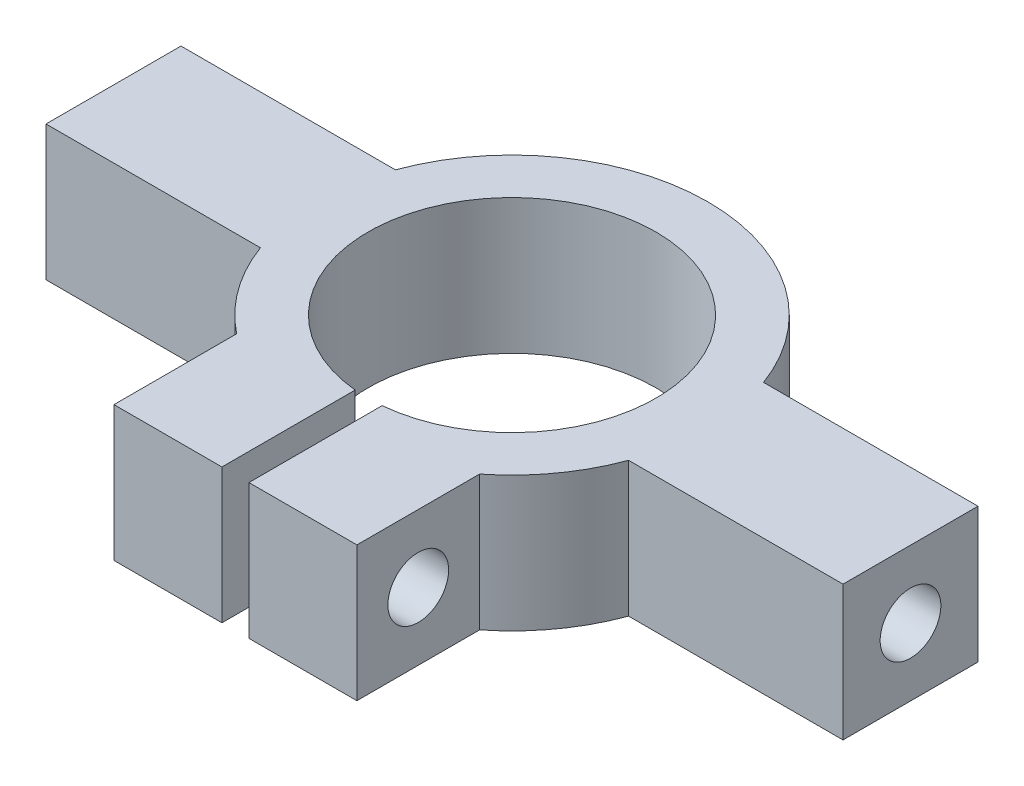
from build123d import *

# Parameters (mm, degrees)
CROQUIS1_R              = 10.668000000000001
SALIENTE_EXTRUIR1_DEPTH = 5
CORTAR_EXTRUIR1_REACH   = 55.921
CROQUIS2_R              = 2.249999999999999
SALIENTE_EXTRUIR2_DEPTH = 2.5
CORTAR_EXTRUIR5_DEPTH   = 55.61204651906025
SALIENTE_EXTRUIR3_DEPTH = 10
CORTAR_EXTRUIR6_REACH   = 65.994
CROQUIS9_R              = 2.250000000000002
CORTAR_EXTRUIR7_DEPTH   = 60.57595316665593
SALIENTE_EXTRUIR4_DEPTH = 10
CROQUIS12_R             = 2.249999999999999
CORTAR_EXTRUIR8_DEPTH   = 10


with BuildPart() as part:
    # Croquis1 → Saliente-Extruir1 (new, symmetric)
    with BuildSketch(Plane(origin=(0, 0, 0), x_dir=(1, 0, 0), z_dir=(0, 1, 0))):
        with BuildLine():
            Line((30, 1.163e-14), (-30, -6.74e-15))
            Line((-30, -6.74e-15), (-29.999999999999993, -10.000000000000007))
            Line((-29.999999999999993, -10.000000000000007), (-4.999999999999997, -9.999999999999998))
            Line((-4.999999999999997, -9.999999999999998), (-4.999999999999997, -16.362711963150442))
            ThreePointArc((-4.999999999999997, -16.362711963150442), (1.01e-15, -44.525000000000006), (5.000000000000002, -16.362711963150442))
            Line((5.000000000000002, -16.362711963150442), (5.000000000000001, -9.999999999999993))
            Line((5.000000000000001, -9.999999999999993), (30, -9.999999999999988))
            Line((30, -9.999999999999988), (30, 1.163e-14))
        make_face()
        with Locations(Location((3.67e-15, -30, 0), (0, 0, 270))):
            Circle(CROQUIS1_R, mode=Mode.SUBTRACT)
    extrude(amount=SALIENTE_EXTRUIR1_DEPTH, both=True)

    # Croquis2 → Cortar-Extruir1 (cut, up to next)
    with BuildSketch(Plane(origin=(0, 0, 0), x_dir=(-1, 0, 3.1e-16), z_dir=(-3.1e-16, 0, -1)), mode=Mode.PRIVATE) as cortar_extruir1_sk1:
        with Locations((24.999999999999996, 0)):
            Circle(CROQUIS2_R)
    cortar_extruir1_tool1 = extrude(cortar_extruir1_sk1.sketch, amount=-CORTAR_EXTRUIR1_REACH, mode=Mode.PRIVATE) & part.part
    # Croquis2 → Cortar-Extruir1 (cut, up to next)
    with BuildSketch(Plane(origin=(0, 0, 0), x_dir=(-1, 0, 3.1e-16), z_dir=(-3.1e-16, 0, -1)), mode=Mode.PRIVATE) as cortar_extruir1_sk2:
        with Locations((-24.999999999999996, 0)):
            Circle(CROQUIS2_R)
    cortar_extruir1_tool2 = extrude(cortar_extruir1_sk2.sketch, amount=-CORTAR_EXTRUIR1_REACH, mode=Mode.PRIVATE) & part.part
    add(cortar_extruir1_tool1.solids().sort_by_distance((-25, 0, 0))[0], mode=Mode.SUBTRACT)
    add(cortar_extruir1_tool2.solids().sort_by_distance((25, 0, 0))[0], mode=Mode.SUBTRACT)

    # Croquis3 → Saliente-Extruir2 (add, symmetric)
    with BuildSketch(Plane(origin=(0, 0, 0), x_dir=(1, 0, 0), z_dir=(0, 1, 0))):
        with BuildLine():
            ThreePointArc((-4.999999999999991, -16.362711963150442), (-12.83879356101969, -23.207282951754927), (-14.087370599725464, -33.53858934972546))
            Line((-14.087370599725464, -33.53858934972546), (-19.999999999999996, -10.000000000000007))
            Line((-19.999999999999996, -10.000000000000007), (-4.999999999999997, -9.999999999999998))
            Line((-4.999999999999997, -9.999999999999998), (-4.999999999999991, -16.362711963150442))
        make_face()
        with BuildLine():
            Line((4.999999999999997, -9.999999999999998), (4.999999999999991, -16.362711963150442))
            ThreePointArc((4.999999999999991, -16.362711963150442), (12.838793561019703, -23.20728295175493), (14.087370599725464, -33.53858934972546))
            Line((14.087370599725464, -33.53858934972546), (19.999999999999996, -10.000000000000007))
            Line((19.999999999999996, -10.000000000000007), (4.999999999999997, -9.999999999999998))
        make_face()
    extrude(amount=SALIENTE_EXTRUIR2_DEPTH, both=True)

    # Croquis7 → Cortar-Extruir5 (cut, through all)
    with BuildSketch(Plane(origin=(0, 5, 0), x_dir=(1, 0, 0), z_dir=(0, 1, 0))):
        Polygon((1.0000000000000004, -46.5965), (-0.9999999999999998, -46.5965), (-0.9999999999999996, -38.5965), (1.0000000000000004, -38.5965), align=None)
    extrude(amount=-CORTAR_EXTRUIR5_DEPTH, mode=Mode.SUBTRACT)

    # Croquis8 → Saliente-Extruir3 (add)
    with BuildSketch(Plane(origin=(0, 5, 0), x_dir=(1, 0, 0), z_dir=(0, 1, 0))):
        with BuildLine():
            Line((-0.9999999999999998, -44.49053570438305), (-0.9999999999999989, -50.49053570438305))
            Line((-0.9999999999999989, -50.49053570438305), (-9, -50.490535704383056))
            Line((-9, -50.490535704383056), (-8.999999999999998, -41.400685286420284))
            ThreePointArc((-8.999999999999998, -41.400685286420284), (-5.233239331556143, -43.5494956031084), (-0.9999999999999998, -44.49053570438305))
        make_face()
        with BuildLine():
            Line((9, -50.490535704383056), (8.999999999999998, -41.400685286420284))
            ThreePointArc((8.999999999999998, -41.400685286420284), (5.23323933155614, -43.5494956031084), (0.9999999999999996, -44.49053570438305))
            Line((0.9999999999999996, -44.49053570438305), (0.9999999999999989, -50.49053570438305))
            Line((0.9999999999999989, -50.49053570438305), (9, -50.490535704383056))
        make_face()
    extrude(amount=-SALIENTE_EXTRUIR3_DEPTH)

    # Cortar-Extruir6: up to this face of the body (flat: up to its plane)
    cortar_extruir6_end = Plane(part.part.faces().sort_by_distance((-9, 0, 45.945610495))[0])
    # Croquis9 → Cortar-Extruir6 (cut, up to the picked face)
    with BuildSketch(Plane(origin=(8.99999999999999, 0, -1.72e-15), x_dir=(0, 0, -1), z_dir=(1, 0, 0)), mode=Mode.PRIVATE) as cortar_extruir6_sk1:
        with Locations((-45.945610495401674, 0)):
            Circle(CROQUIS9_R)
    cortar_extruir6_tool1 = split(extrude(cortar_extruir6_sk1.sketch, amount=-CORTAR_EXTRUIR6_REACH, mode=Mode.PRIVATE), bisect_by=cortar_extruir6_end, keep=Keep.BOTH, mode=Mode.PRIVATE)
    add(cortar_extruir6_tool1.solids().sort_by(Axis((9, 0, 45.94561), (-1, 0, 0)))[0], mode=Mode.SUBTRACT)

    # Croquis10 → Cortar-Extruir7 (cut, through all)
    with BuildSketch(Plane(origin=(0, 5, 0), x_dir=(1, 0, 0), z_dir=(0, 1, 0))):
        with BuildLine():
            ThreePointArc((-4.999999999999991, -16.362711963150442), (4.56e-15, -15.475), (5, -16.362711963150446))
            Line((5, -16.362711963150446), (5.000000000000001, -9.999999999999993))
            Line((5.000000000000001, -9.999999999999993), (30, -9.999999999999988))
            Line((30, -9.999999999999988), (30, 1.163e-14))
            Line((30, 1.163e-14), (-30, -6.74e-15))
            Line((-30, -6.74e-15), (-29.999999999999993, -10.000000000000007))
            Line((-29.999999999999993, -10.000000000000007), (-4.999999999999997, -9.999999999999998))
            Line((-4.999999999999997, -9.999999999999998), (-4.999999999999991, -16.362711963150442))
        make_face()
        with BuildLine():
            ThreePointArc((-14.087370599725464, -33.53858934972547), (-12.838793561019695, -23.207282951754934), (-4.999999999999991, -16.362711963150442))
            Line((-4.999999999999991, -16.362711963150442), (-4.999999999999997, -9.999999999999998))
            Line((-4.999999999999997, -9.999999999999998), (-20, -10.000000000000004))
            Line((-20, -10.000000000000004), (-14.087370599725462, -33.53858934972547))
        make_face()
        with BuildLine():
            Line((20.000000000000004, -9.99999999999999), (5, -9.999999999999993))
            Line((5.000000000000001, -9.999999999999993), (5.000000000000002, -16.362711963150442))
            ThreePointArc((5, -16.36271196315044), (12.838793561019697, -23.207282951754934), (14.08737059972547, -33.53858934972546))
            Line((14.087370599725467, -33.53858934972546), (20.000000000000004, -9.99999999999999))
        make_face()
    extrude(amount=-CORTAR_EXTRUIR7_DEPTH, mode=Mode.SUBTRACT)

    # Croquis11 → Saliente-Extruir4 (add)
    with BuildSketch(Plane(origin=(0, 5, 0), x_dir=(1, 0, 0), z_dir=(0, 1, 0))):
        with BuildLine():
            Line((29.525000000000002, -34.99999999999999), (29.525, -25))
            Line((29.525, -25), (13.637288036849554, -25))
            ThreePointArc((13.637288036849554, -25), (14.525, -30), (13.637288036849556, -35))
            Line((13.637288036849556, -35), (29.525000000000002, -34.99999999999999))
        make_face()
        with BuildLine():
            Line((-29.525000000000002, -34.99999999999999), (-13.637288036849556, -35))
            ThreePointArc((-13.637288036849556, -35), (-14.525, -30.000000000000004), (-13.637288036849554, -25))
            Line((-13.637288036849554, -25), (-29.525, -25))
            Line((-29.525, -25), (-29.525000000000002, -34.99999999999999))
        make_face()
    extrude(amount=-SALIENTE_EXTRUIR4_DEPTH)

    # Croquis12 → Cortar-Extruir8 (cut)
    with BuildSketch(Plane(origin=(29.524999999999988, 0, -1.024e-14), x_dir=(-3.5e-16, 0, -1), z_dir=(1, 0, -3.5e-16))):
        with Locations((-30.000000000000007, -8.7e-16)):
            Circle(CROQUIS12_R)
    cortar_extruir8 = extrude(amount=-CORTAR_EXTRUIR8_DEPTH, mode=Mode.SUBTRACT)

    # Simetría1: Cortar-Extruir8 across plane
    add(cortar_extruir8.mirror(Plane(origin=(0, 0, 0), x_dir=(0, 0, 1), z_dir=(1, 0, 0))), mode=Mode.SUBTRACT)


solid = part.part
